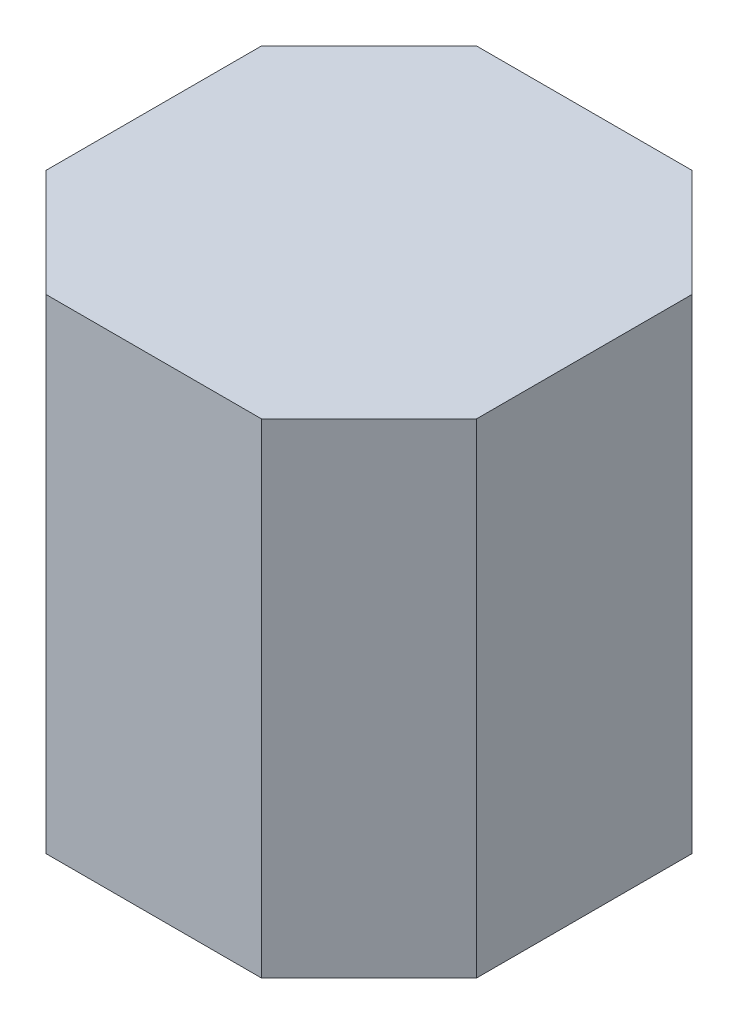
from build123d import *

# Parameters (mm, degrees)
BOSS_EXTRU_1_DEPTH      = 90
ESQUISSE3_R             = 25
ENL_V_MAT_EXTRU_1_DEPTH = 70
ESQUISSE5_R             = 2
ENL_V_MAT_EXTRU_3_DEPTH = 15


with BuildPart() as part:
    # Esquisse2 → Boss.-Extru.1 (new body)
    with BuildSketch(Plane(origin=(0, 0, 0), x_dir=(1, 0, 0), z_dir=(0, 1, 0))):
        Polygon((-20, 40), (-40, 20), (-40, -20), (-20, -40), (20, -40), (40, -20), (40, 20), (20, 40), align=None)
    extrude(amount=BOSS_EXTRU_1_DEPTH)

    # Esquisse3 → Enlèv. mat.-Extru.1 (cut)
    with BuildSketch(Plane.XZ):
        with Locations(Location((0, 0, 0), (0, 0, 270))):
            Circle(ESQUISSE3_R)
    extrude(amount=-ENL_V_MAT_EXTRU_1_DEPTH, mode=Mode.SUBTRACT)

    # Esquisse5 → Enlèv. mat.-Extru.3 (cut)
    with BuildSketch(Plane.XZ):
        with Locations(Location((-32, 0, 0), (0, 0, 270))):
            Circle(ESQUISSE5_R)
        with Locations(Location((0, -32, 0), (0, 0, 270))):
            Circle(ESQUISSE5_R)
        with Locations(Location((32, 0, 0), (0, 0, 270))):
            Circle(ESQUISSE5_R)
        with Locations(Location((0, 32, 0), (0, 0, 270))):
            Circle(ESQUISSE5_R)
    extrude(amount=-ENL_V_MAT_EXTRU_3_DEPTH, mode=Mode.SUBTRACT)


solid = part.part
